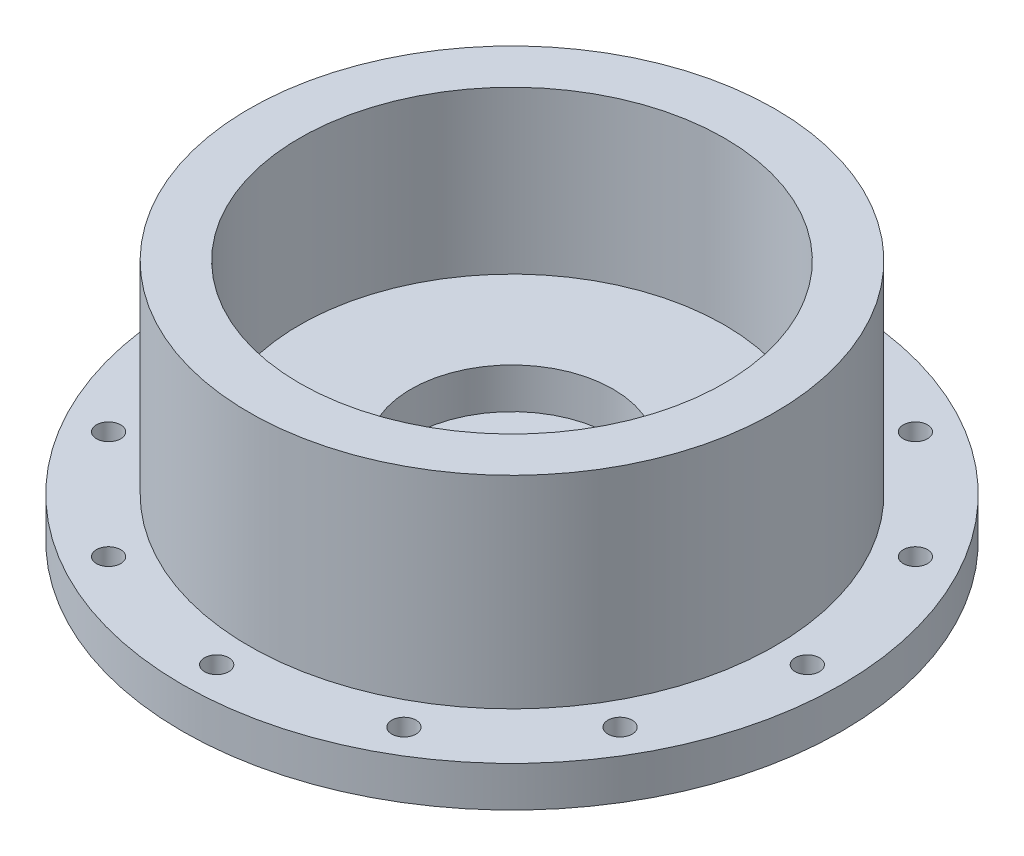
from build123d import *

# Parameters (mm, degrees)
BOSS_EXTRUDE1_START = -20
SKETCH2_R           = 81.5
SKETCH2_R_2         = 3
BOSS_EXTRUDE1_DEPTH = 10


with BuildPart() as part:
    # Sketch1 → Revolve1 (revolve)
    with BuildSketch(Plane(origin=(0, 0, 0), x_dir=(0, 0, -1), z_dir=(1, 0, 0))):
        Polygon((25, 0), (25, -10), (0, -10), (0, -20), (65, -20), (65, -10), (65, 40), (52.5, 40), (52.5, 0), align=None)
    revolve(axis=Axis((0, 0, 0), (0, 1, 0)))

    # Sketch2 → Boss-Extrude1 (add)
    with BuildSketch(Plane(origin=(0, 0, 0), x_dir=(1, 0, 0), z_dir=(0, 1, 0)).offset(BOSS_EXTRUDE1_START)):
        with Locations(Location((0, 0, 0), (0, 0, 90))):
            Circle(SKETCH2_R)
        with Locations(Location((0, 73, 0), (0, 0, 90))):
            Circle(SKETCH2_R_2, mode=Mode.SUBTRACT)
        with Locations(Location((36.5, 63.219854476, 0), (0, 0, 90))):
            Circle(SKETCH2_R_2, mode=Mode.SUBTRACT)
        with Locations(Location((63.219854476, 36.5, 0), (0, 0, 90))):
            Circle(SKETCH2_R_2, mode=Mode.SUBTRACT)
        with Locations(Location((73, 0, 0), (0, 0, 90))):
            Circle(SKETCH2_R_2, mode=Mode.SUBTRACT)
        with Locations(Location((63.219854476, -36.5, 0), (0, 0, 90))):
            Circle(SKETCH2_R_2, mode=Mode.SUBTRACT)
        with Locations(Location((36.5, -63.219854476, 0), (0, 0, 90))):
            Circle(SKETCH2_R_2, mode=Mode.SUBTRACT)
        with Locations(Location((0, -73, 0), (0, 0, 90))):
            Circle(SKETCH2_R_2, mode=Mode.SUBTRACT)
        with Locations(Location((-36.5, -63.219854476, 0), (0, 0, 90))):
            Circle(SKETCH2_R_2, mode=Mode.SUBTRACT)
        with Locations(Location((-63.219854476, -36.5, 0), (0, 0, 90))):
            Circle(SKETCH2_R_2, mode=Mode.SUBTRACT)
        with Locations(Location((-73, 0, 0), (0, 0, 90))):
            Circle(SKETCH2_R_2, mode=Mode.SUBTRACT)
        with Locations(Location((-63.219854476, 36.5, 0), (0, 0, 90))):
            Circle(SKETCH2_R_2, mode=Mode.SUBTRACT)
        with Locations(Location((-36.5, 63.219854476, 0), (0, 0, 90))):
            Circle(SKETCH2_R_2, mode=Mode.SUBTRACT)
    extrude(amount=BOSS_EXTRUDE1_DEPTH)


solid = part.part
